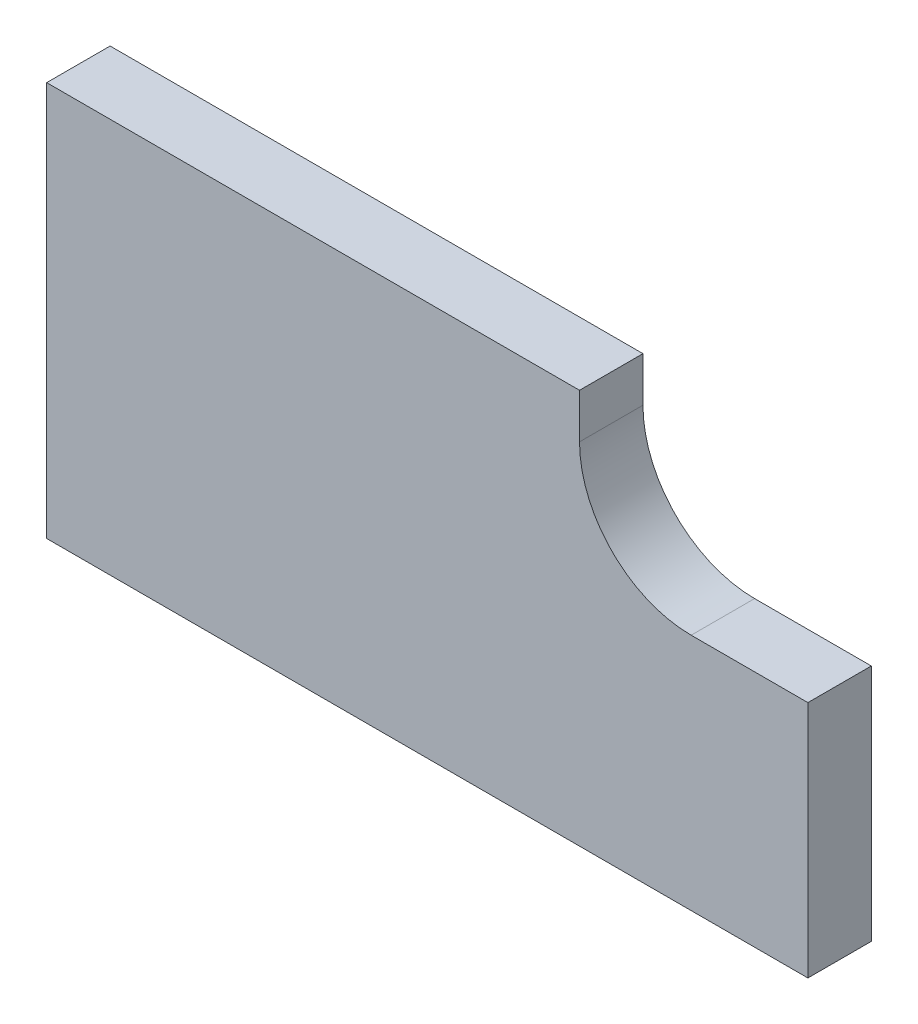
from build123d import *

# Parameters (mm, degrees)
BOSS_EXTRUDE1_DEPTH = 5.5
BOSS_EXTRUDE2_DEPTH = 7
SKETCH3_W           = 105
SKETCH3_H           = 14.2
CUT_EXTRUDE1_DEPTH  = 177.40932515


with BuildPart() as part:
    # Sketch1 → Boss-Extrude1 (new body)
    with BuildSketch(Plane.XY):
        with BuildLine():
            Line((127, 47), (150, 47))
            Line((150, 47), (150, 0))
            Line((150, 0), (0, 0))
            Line((0, 0), (0, 69))
            Line((0, 69), (0, 92))
            Line((0, 92), (105, 92))
            Line((105, 92), (105, 69))
            ThreePointArc((105, 69), (111.443650814, 53.443650814), (127, 47))
        make_face()
    extrude(amount=BOSS_EXTRUDE1_DEPTH)

    # Sketch2 → Boss-Extrude2 (add)
    with BuildSketch(Plane.XY.offset(5.5)):
        with BuildLine():
            Line((0, 92), (0, 0))
            Line((0, 0), (150, 0))
            Line((150, 0), (150, 47))
            Line((150, 47), (127, 47))
            ThreePointArc((127, 47), (111.443650814, 53.443650814), (105, 69))
            Line((105, 69), (105, 92))
            Line((105, 92), (0, 92))
        make_face()
    extrude(amount=BOSS_EXTRUDE2_DEPTH)

    # Sketch3 → Cut-Extrude1 (cut, through all)
    with BuildSketch(Plane.XY.offset(12.5)):
        with Locations((52.5, 84.9)):
            Rectangle(SKETCH3_W, SKETCH3_H)
    extrude(amount=-CUT_EXTRUDE1_DEPTH, mode=Mode.SUBTRACT)


solid = part.part
